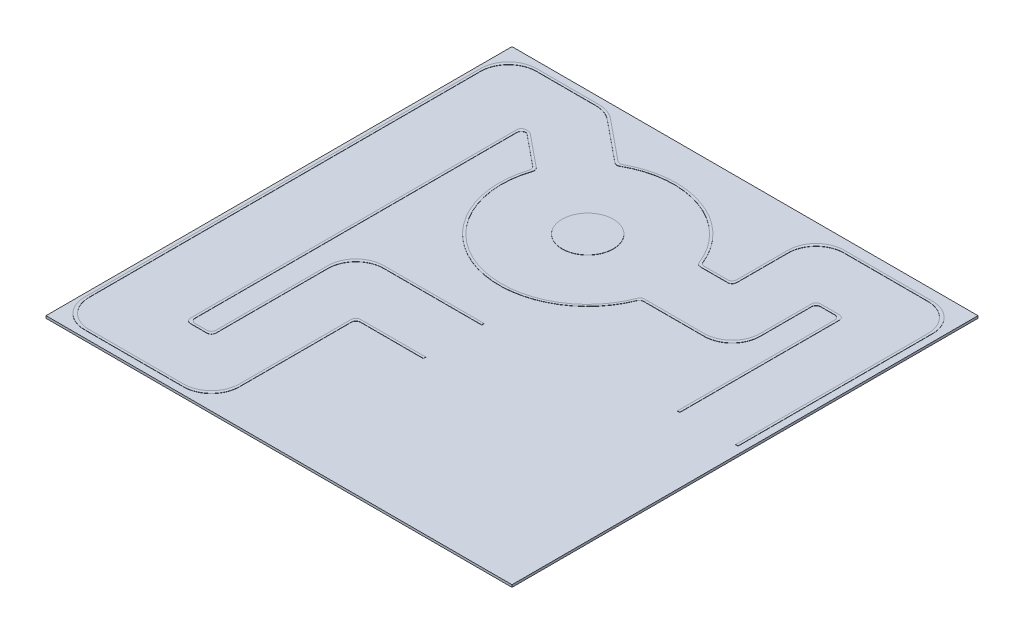
from build123d import *

# Parameters (mm, degrees)
ESQUISSE2_W        = 2000
ESQUISSE2_H        = 2000
BOSS_EXTRU_2_DEPTH = 10
ESQUISSE1_R        = 110
BOSS_EXTRU_6_DEPTH = 1


with BuildPart() as part:
    # Esquisse2 → Boss.-Extru.2 (new body)
    with BuildSketch(Plane(origin=(0, 0, 0), x_dir=(1, 0, 0), z_dir=(0, 1, 0))):
        Rectangle(ESQUISSE2_W, ESQUISSE2_H)
    extrude(amount=-BOSS_EXTRU_2_DEPTH)

    # Esquisse1 → Boss.-Extru.6 (add)
    with BuildSketch(Plane(origin=(0, 0, 0), x_dir=(1, 0, 0), z_dir=(0, 1, 0))):
        with Locations(Location((-140, 465, 0), (0, 0, 90))):
            Circle(ESQUISSE1_R)
        with BuildLine():
            Line((-30, -100), (-450, -100))
            ThreePointArc((-450, -100), (-534.852813742, -135.147186258), (-570, -220))
            Line((-570, -220), (-570, -700))
            ThreePointArc((-570, -700), (-575.857864376, -714.142135624), (-590, -720))
            Line((-590, -720), (-660, -720))
            ThreePointArc((-660, -720), (-674.142135624, -714.142135624), (-680, -700))
            Line((-680, -700), (-680, 700))
            ThreePointArc((-680, 700), (-674.142135624, 714.142135624), (-660, 720))
            Line((-660, 720), (-649.834574491, 720))
            ThreePointArc((-649.834574491, 720), (-643.12759549, 718.841879754), (-637.197365306, 715.501643268))
            Line((-637.197365306, 715.501643268), (-497.957421247, 601.990819307))
            ThreePointArc((-497.957421247, 601.990819307), (-491.401573638, 592.112926645), (-491.58977759, 580.258961883))
            ThreePointArc((-491.58977759, 580.258961883), (-264.079111523, 116.425224545), (205.33854603, 332.179487179))
            ThreePointArc((205.33854603, 332.179487179), (212.682724123, 341.486202467), (224.005494464, 345))
            Line((224.005494464, 345), (480, 345))
            ThreePointArc((480, 345), (564.852813742, 380.147186258), (600, 465))
            Line((600, 465), (600, 685))
            ThreePointArc((600, 685), (605.857864376, 699.142135624), (620, 705))
            Line((620, 705), (700, 705))
            ThreePointArc((700, 705), (714.142135624, 699.142135624), (720, 685))
            Line((720, 685), (720, 0))
            Line((720, 0), (710, 0))
            Line((710, 0), (710, 675))
            ThreePointArc((710, 675), (704.142135624, 689.142135624), (690, 695))
            Line((690, 695), (630, 695))
            ThreePointArc((630, 695), (615.857864376, 689.142135624), (610, 675))
            Line((610, 675), (610, 455))
            ThreePointArc((610, 455), (574.852813742, 370.147186258), (490, 335))
            Line((490, 335), (230.809924355, 335))
            ThreePointArc((230.809924355, 335), (219.629584467, 331.583123952), (212.269428137, 322.5))
            ThreePointArc((212.269428137, 322.5), (-267.432601024, 107.004284668), (-503.077865902, 577.135914371))
            ThreePointArc((-503.077865902, 577.135914371), (-503.043324922, 588.826673493), (-509.55001808, 598.539447869))
            Line((-509.55001808, 598.539447869), (-646.274962028, 710))
            Line((-646.274962028, 710), (-650, 710))
            ThreePointArc((-650, 710), (-664.142135624, 704.142135624), (-670, 690))
            Line((-670, 690), (-670, -690))
            ThreePointArc((-670, -690), (-664.142135624, -704.142135624), (-650, -710))
            Line((-650, -710), (-600, -710))
            ThreePointArc((-600, -710), (-585.857864376, -704.142135624), (-580, -690))
            Line((-580, -690), (-580, -210))
            ThreePointArc((-580, -210), (-544.852813742, -125.147186258), (-460, -90))
            Line((-460, -90), (-30, -90))
            Line((-30, -90), (-30, -100))
        make_face()
        with BuildLine():
            Line((-30, -340), (-310, -340))
            ThreePointArc((-310, -340), (-324.142135624, -345.857864376), (-330, -360))
            Line((-330, -360), (-330, -840))
            ThreePointArc((-330, -840), (-365.147186258, -924.852813742), (-450, -960))
            Line((-450, -960), (-855, -960))
            ThreePointArc((-855, -960), (-939.852813742, -924.852813742), (-975, -840))
            Line((-975, -840), (-975, 840))
            ThreePointArc((-975, 840), (-939.852813742, 924.852813742), (-855, 960))
            Line((-855, 960), (-600, 960))
            ThreePointArc((-600, 960), (-559.758125993, 953.051278526), (-524.176744886, 933.009859606))
            Line((-524.176744886, 933.009859606), (-346.310911019, 788.010538519))
            ThreePointArc((-346.310911019, 788.010538519), (-335.314603965, 783.579609444), (-323.741717124, 786.152582721))
            ThreePointArc((-323.741717124, 786.152582721), (-15.920888477, 813.574775455), (205.33854603, 597.820512821))
            ThreePointArc((205.33854603, 597.820512821), (212.682724123, 588.513797533), (224.005494464, 585))
            Line((224.005494464, 585), (340, 585))
            ThreePointArc((340, 585), (354.142135624, 590.857864376), (360, 605))
            Line((360, 605), (360, 825))
            ThreePointArc((360, 825), (395.147186258, 909.852813742), (480, 945))
            Line((480, 945), (840, 945))
            ThreePointArc((840, 945), (924.852813742, 909.852813742), (960, 825))
            Line((960, 825), (960, 0))
            Line((960, 0), (970, 0))
            Line((970, 0), (970, 835))
            ThreePointArc((970, 835), (934.852813742, 919.852813742), (850, 955))
            Line((850, 955), (470, 955))
            ThreePointArc((470, 955), (385.147186258, 919.852813742), (350, 835))
            Line((350, 835), (350, 615))
            ThreePointArc((350, 615), (344.142135624, 600.857864376), (330, 595))
            Line((330, 595), (230.809924355, 595))
            ThreePointArc((230.809924355, 595), (219.629584467, 598.416876048), (212.269428137, 607.5))
            ThreePointArc((212.269428137, 607.5), (-12.567398976, 822.995715332), (-322.997635007, 798.034330936))
            ThreePointArc((-322.997635007, 798.034330936), (-334.44162777, 795.644755332), (-345.266298667, 800.060810349))
            Line((-345.266298667, 800.060810349), (-520.617132423, 943.009859606))
            ThreePointArc((-520.617132423, 943.009859606), (-556.198513529, 963.051278526), (-596.440387536, 970))
            Line((-596.440387536, 970), (-865, 970))
            ThreePointArc((-865, 970), (-949.852813742, 934.852813742), (-985, 850))
            Line((-985, 850), (-985, -850))
            ThreePointArc((-985, -850), (-949.852813742, -934.852813742), (-865, -970))
            Line((-865, -970), (-440, -970))
            ThreePointArc((-440, -970), (-355.147186258, -934.852813742), (-320, -850))
            Line((-320, -850), (-320, -370))
            ThreePointArc((-320, -370), (-314.142135624, -355.857864376), (-300, -350))
            Line((-300, -350), (-30, -350))
            Line((-30, -350), (-30, -340))
        make_face()
    extrude(amount=BOSS_EXTRU_6_DEPTH)


solid = part.part
